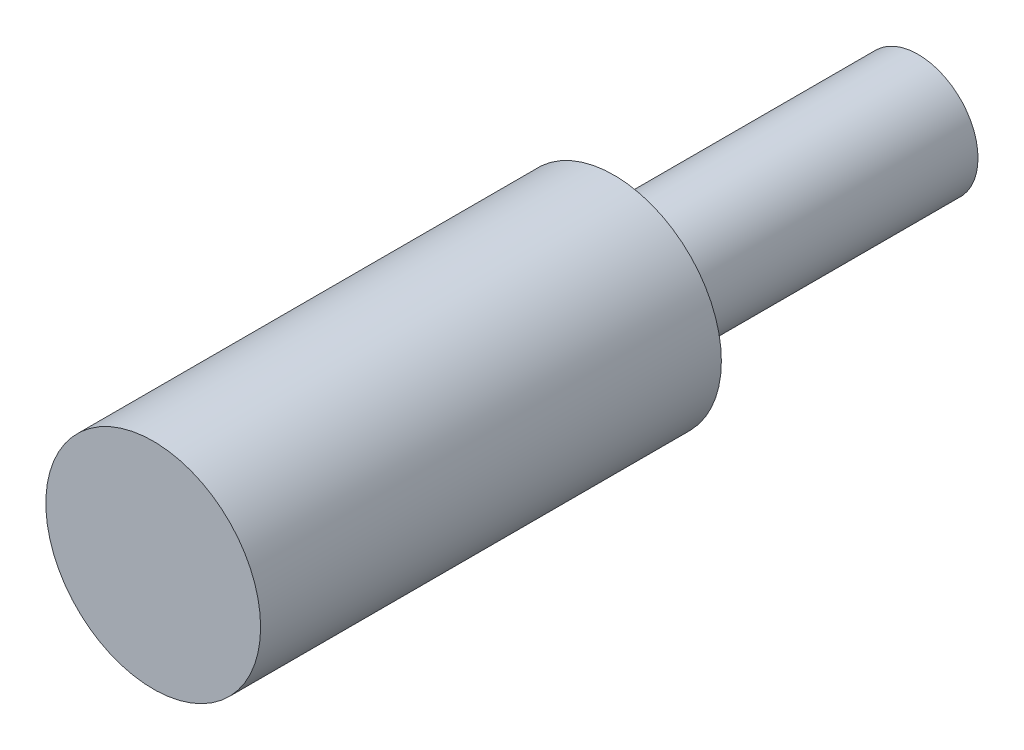
from build123d import *

# Parameters (mm, degrees)
ESQUISSE1_R        = 6.5
BOSS_EXTRU_1_DEPTH = 33
ESQUISSE2_R        = 11.652657894
BOSS_EXTRU_2_DEPTH = 50


with BuildPart() as part:
    # Esquisse1 → Boss.-Extru.1 (new body)
    with BuildSketch(Plane.XY):
        Circle(ESQUISSE1_R)
    extrude(amount=BOSS_EXTRU_1_DEPTH)

    # Esquisse2 → Boss.-Extru.2 (add)
    with BuildSketch(Plane.XY.offset(33)):
        Circle(ESQUISSE2_R)
    extrude(amount=BOSS_EXTRU_2_DEPTH)


solid = part.part
